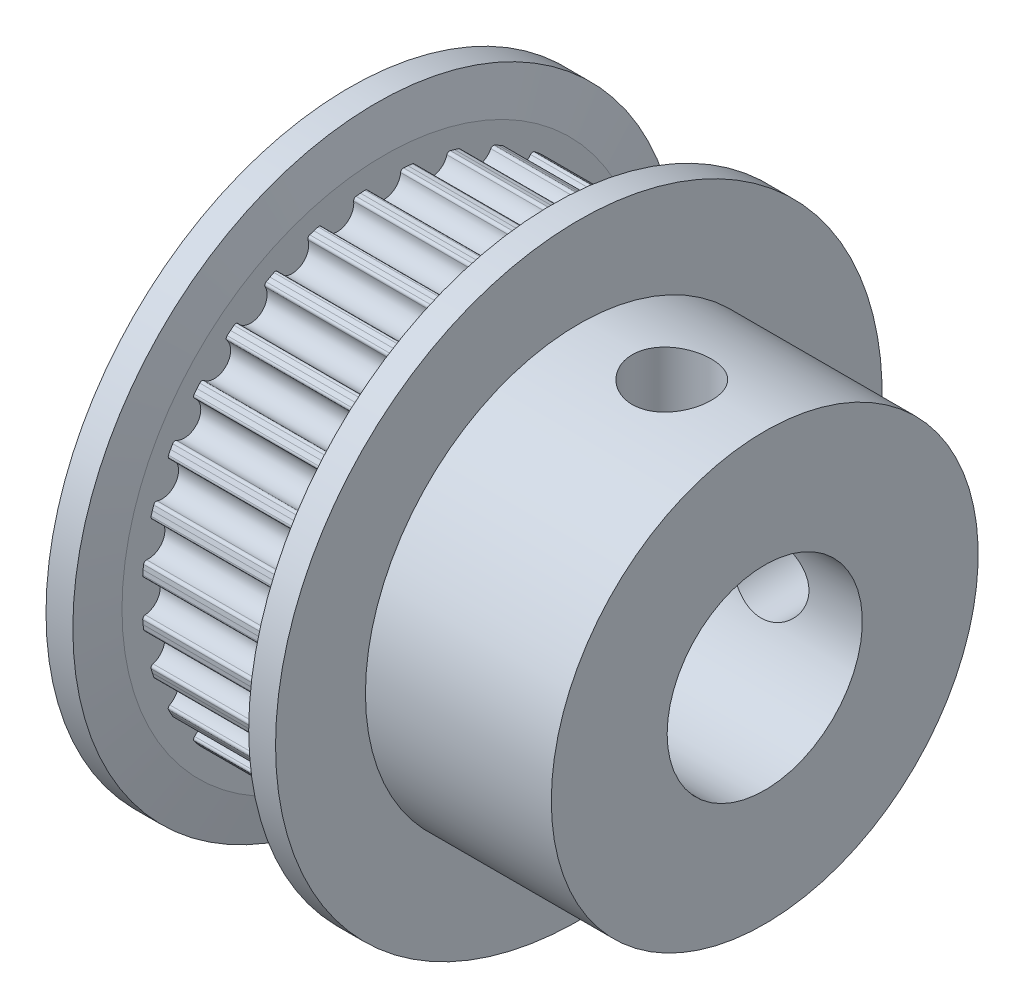
from build123d import *

# Parameters (mm, degrees)
CUT_EXTRUDE1_DEPTH = 6.55
CIRPATTERN1_COUNT  = 32
SKETCH39_R         = 4.001
CUT_EXTRUDE2_DEPTH = 17.03
SKETCH37_W         = 1.621
SKETCH37_H         = 9.93
CIRPATTERN2_COUNT  = 2
CIRPATTERN2_ANGLE  = 90


with BuildPart() as part:
    # Sketch1 → Revolve1 (revolve)
    with BuildSketch(Plane.XY, mode=Mode.PRIVATE) as revolve1_sk:
        Polygon((0, 0), (0, 8.75), (1.43, 8.75), (1.43, 10.088071429), (7.98, 10.088071429), (7.98, 8.75), (17.03, 8.75), (17.03, 0), align=None)
    revolve(revolve1_sk.sketch.rotate(Axis((17.03, 0, 0), (-1, 0, 0)), 270), axis=Axis((17.03, 0, 0), (-1, 0, 0)))

    # Sketch2 → Cut-Extrude1 (cut)
    with BuildSketch(Plane(origin=(1.43, 0, 0), x_dir=(0, 0, -1), z_dir=(1, 0, 0))):
        with BuildLine():
            Line((-1.03437385, 9.879953537), (-1.057813893, 10.129918794))
            ThreePointArc((-1.057813893, 10.129918794), (0, 10.185), (1.057813893, 10.129918794))
            Line((1.057813893, 10.129918794), (1.03437385, 9.879953537))
            Line((1.03437385, 9.879953537), (0.792969158, 9.89929093))
            ThreePointArc((0.792969158, 9.89929093), (0.711706777, 9.87316989), (0.672449407, 9.797375812))
            ThreePointArc((0.672449407, 9.797375812), (0, 9.181), (-0.672449407, 9.797375812))
            ThreePointArc((-0.672449407, 9.797375812), (-0.711706777, 9.87316989), (-0.792969158, 9.89929093))
            Line((-0.792969158, 9.89929093), (-1.03437385, 9.879953537))
        make_face()
    cut_extrude1 = extrude(amount=CUT_EXTRUDE1_DEPTH, mode=Mode.SUBTRACT)

    # CirPattern1: Cut-Extrude1 ×32 about axis
    cirpattern1_axis = Axis((0, 0, 0), (1, 0, 0))
    for i in range(1, CIRPATTERN1_COUNT):
        add(cut_extrude1.rotate(cirpattern1_axis, i * 360 / CIRPATTERN1_COUNT), mode=Mode.SUBTRACT)

    # Sketch34 → Revolve2 (revolve)
    with BuildSketch(Plane.XY, mode=Mode.PRIVATE) as revolve2_sk:
        Polygon((7.98, 8.75), (7.98, 10.75), (8.31, 12.435), (9.41, 12.435), (9.41, 8.75), align=None)
        Polygon((1.43, 8.75), (1.43, 10.75), (1.1, 12.435), (0, 12.435), (0, 8.76), (0.01, 8.75), align=None)
    revolve(revolve2_sk.sketch.rotate(Axis((17.03, 0, 0), (-1, 0, 0)), 270), axis=Axis((17.03, 0, 0), (-1, 0, 0)))

    # Sketch39 → Cut-Extrude2 (cut)
    with BuildSketch(Plane.ZY):
        Circle(SKETCH39_R)
    extrude(amount=-CUT_EXTRUDE2_DEPTH, mode=Mode.SUBTRACT)

    # Sketch37 → Cut-Revolve2 (revolve, cut)
    with BuildSketch(Plane(origin=(13.22, 0, 0), x_dir=(0, 0, -1), z_dir=(1, 0, 0)), mode=Mode.PRIVATE) as cut_revolve2_sk:
        with Locations((0.8105, 4.965)):
            Rectangle(SKETCH37_W, SKETCH37_H)
    cut_revolve2 = revolve(cut_revolve2_sk.sketch.rotate(Axis((13.22, 0, 0), (0, 1, 0)), 180), axis=Axis((13.22, 0, 0), (0, 1, 0)), mode=Mode.SUBTRACT)

    # CirPattern2: Cut-Revolve2 ×2 about axis
    cirpattern2_axis = Axis((17.03, 0, 0), (-1, 0, 0))
    for i in range(1, CIRPATTERN2_COUNT):
        add(cut_revolve2.rotate(cirpattern2_axis, i * CIRPATTERN2_ANGLE / (CIRPATTERN2_COUNT - 1)), mode=Mode.SUBTRACT)


solid = part.part
